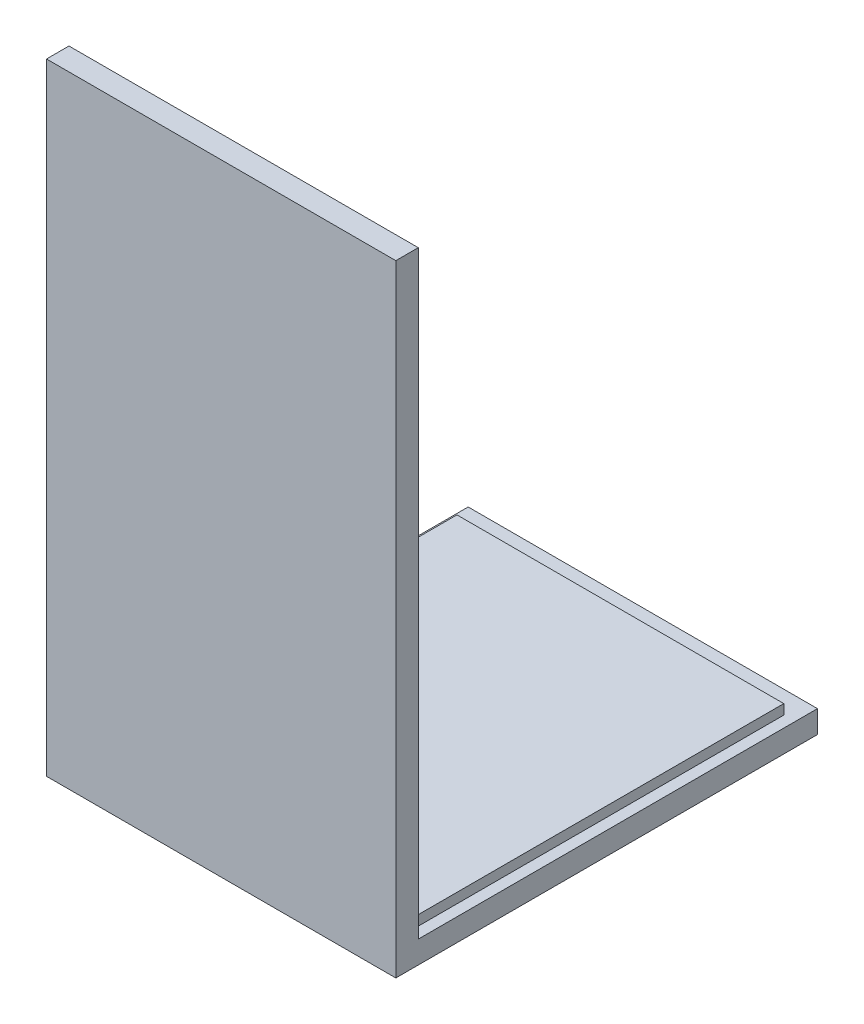
from build123d import *

# Parameters (mm, degrees)
SKETCH1_W           = 124.5
SKETCH1_H           = 70
BOSS_EXTRUDE1_DEPTH = 4.5
SKETCH2_W           = 70
SKETCH2_H           = 4.5
BOSS_EXTRUDE2_DEPTH = 80
SKETCH3_W           = 65.5
SKETCH3_H           = 2
BOSS_EXTRUDE3_DEPTH = 75.5


with BuildPart() as part:
    # Sketch1 → Boss-Extrude1 (new body)
    with BuildSketch(Plane(origin=(0, 0, 0), x_dir=(0, 1, 0), z_dir=(0, 0, 1))):
        with Locations((62.25, 35)):
            Rectangle(SKETCH1_W, SKETCH1_H)
    extrude(amount=BOSS_EXTRUDE1_DEPTH)

    # Sketch2 → Boss-Extrude2 (add)
    with BuildSketch(Plane(origin=(0, 0, 0), x_dir=(1, 0, 0), z_dir=(0, 0, -1))):
        with Locations((-35, -2.25)):
            Rectangle(SKETCH2_W, SKETCH2_H)
    extrude(amount=BOSS_EXTRUDE2_DEPTH)

    # Sketch3 → Boss-Extrude3 (add)
    with BuildSketch(Plane(origin=(0, 0, 0), x_dir=(1, 0, 0), z_dir=(0, 0, -1))):
        with Locations((-35, -5.5)):
            Rectangle(SKETCH3_W, SKETCH3_H)
    extrude(amount=BOSS_EXTRUDE3_DEPTH)


solid = part.part
